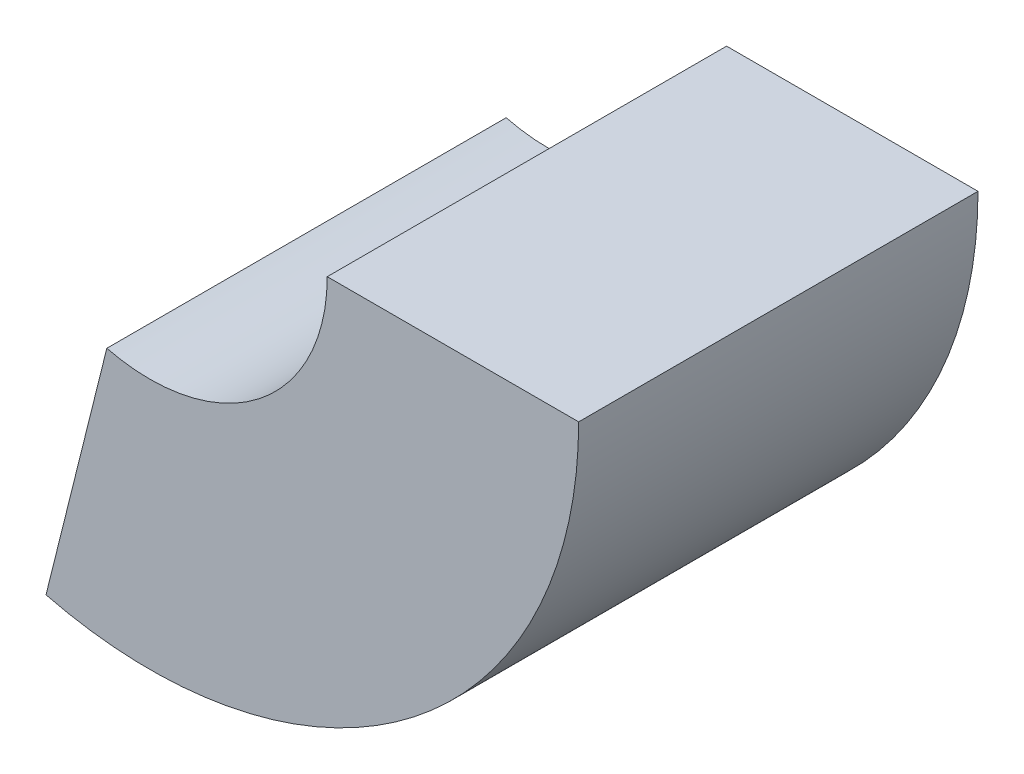
from build123d import *

# Parameters (mm, degrees)
REVOLVESKETCH_W           = 17
REVOLVESKETCH_H           = 27
ORDINARYBOSSREVOLVE_ANGLE = 104


with BuildPart() as part:
    # RevolveSketch → OrdinaryBossRevolve (revolve)
    with BuildSketch(Plane(origin=(0, 0, 0), x_dir=(1, 0, 0), z_dir=(0, 1, 0))):
        with Locations((24.5, 2.5)):
            Rectangle(REVOLVESKETCH_W, REVOLVESKETCH_H)
    revolve(axis=Axis((4, 0, 16), (0, 0, -1)), revolution_arc=ORDINARYBOSSREVOLVE_ANGLE)


solid = part.part
